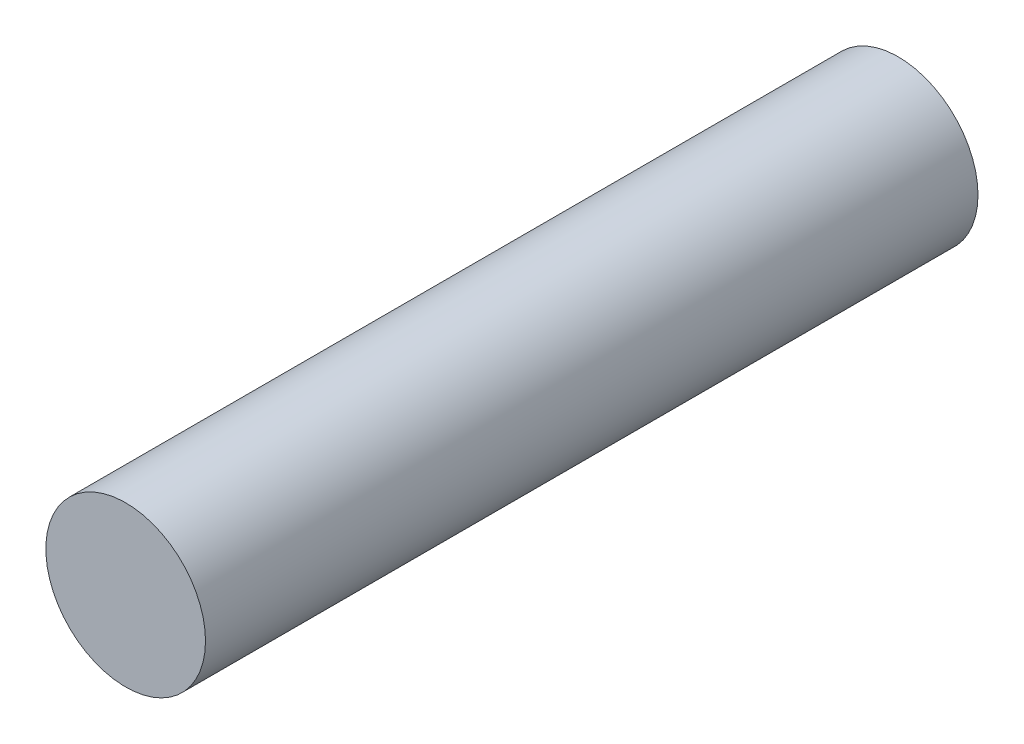
from build123d import *

# Parameters (mm, degrees)
SKETCH1_R           = 31
BOSS_EXTRUDE1_DEPTH = 150


with BuildPart() as part:
    # Sketch1 → Boss-Extrude1 (new, symmetric)
    with BuildSketch(Plane.XY):
        Circle(SKETCH1_R)
    extrude(amount=BOSS_EXTRUDE1_DEPTH, both=True)


solid = part.part
